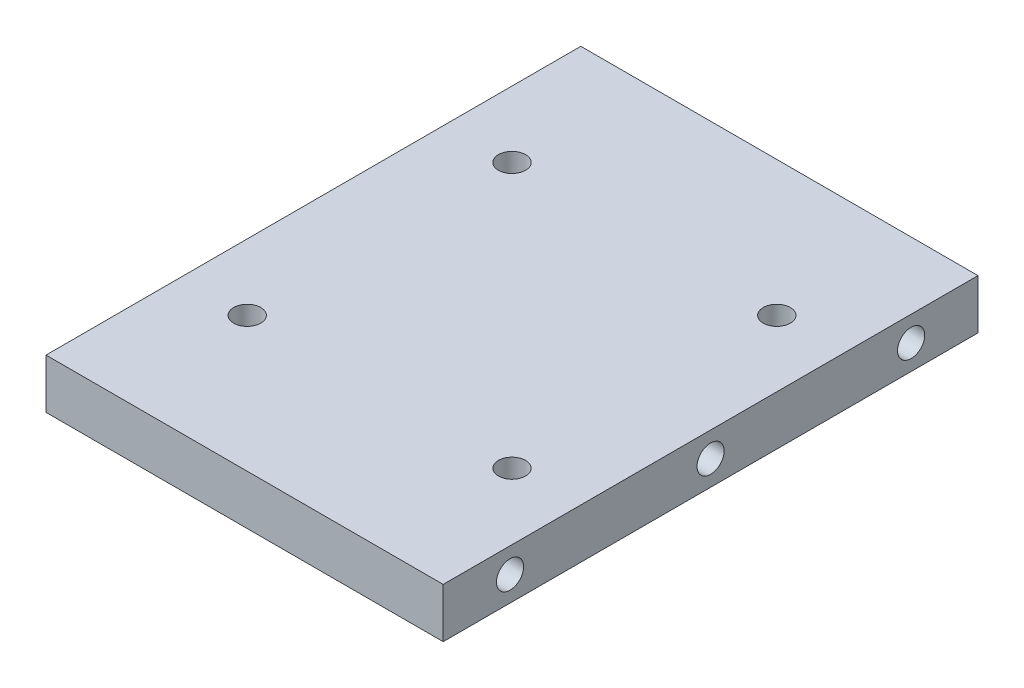
from build123d import *

# Parameters (mm, degrees)
SKETCH1_W           = 76.2
SKETCH1_H           = 102.603301604
SKETCH1_R           = 2.6035
BOSS_EXTRUDE1_DEPTH = 9.525
SKETCH2_R           = 2.6035
CUT_EXTRUDE1_DEPTH  = 122.484770136


with BuildPart() as part:
    # Sketch1 → Boss-Extrude1 (new body)
    with BuildSketch(Plane(origin=(0, 69.975, 0), x_dir=(1, 0, 0), z_dir=(0, 1, 0))):
        Rectangle(SKETCH1_W, SKETCH1_H)
        with Locations(Location((25.4, -25.4, 0), (0, 0, 90))):
            Circle(SKETCH1_R, mode=Mode.SUBTRACT)
        with Locations(Location((-25.4, -25.4, 0), (0, 0, 90))):
            Circle(SKETCH1_R, mode=Mode.SUBTRACT)
        with Locations(Location((-25.4, 25.4, 0), (0, 0, 90))):
            Circle(SKETCH1_R, mode=Mode.SUBTRACT)
        with Locations(Location((25.4, 25.4, 0), (0, 0, 90))):
            Circle(SKETCH1_R, mode=Mode.SUBTRACT)
    extrude(amount=BOSS_EXTRUDE1_DEPTH)

    # Sketch2 → Cut-Extrude1 (cut, through all)
    with BuildSketch(Plane.ZY.offset(38.1)):
        with Locations((0, 74.7375)):
            Circle(SKETCH2_R)
        with Locations((-38.476238101, 74.7375)):
            Circle(SKETCH2_R)
        with Locations((38.476238101, 74.7375)):
            Circle(SKETCH2_R)
    extrude(amount=-CUT_EXTRUDE1_DEPTH, mode=Mode.SUBTRACT)


solid = part.part
